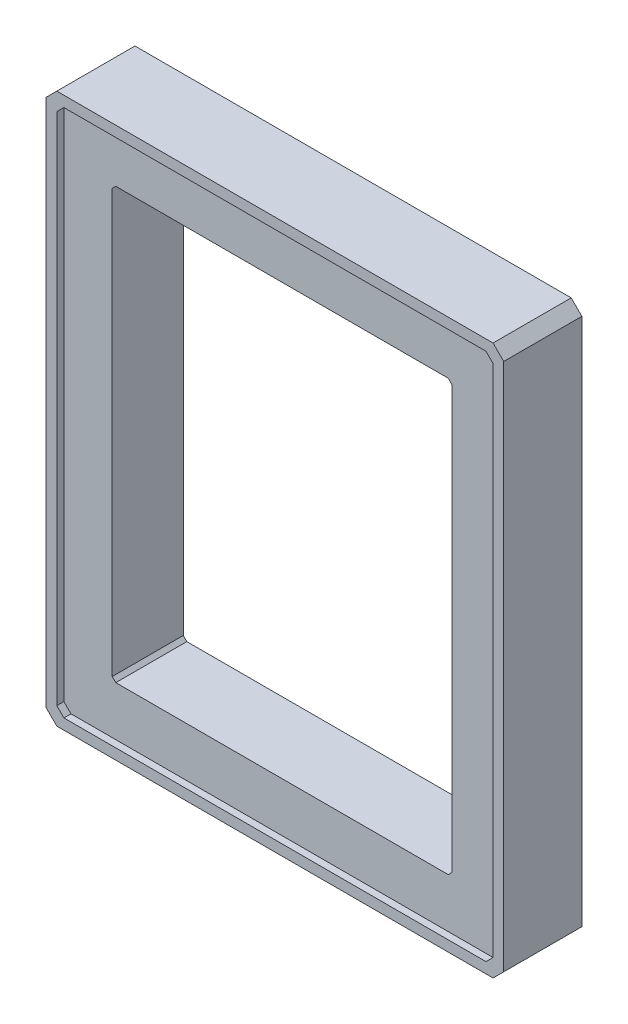
from build123d import *

# Parameters (mm, degrees)
SUPPORT_PLANE_EXACTLY_20MM_ABOVE_TABLE_DEPTH   = 20
LOW_LOCATING_LIP_0P4MM_CLEARANCE_EACH_SI_START = 20
LOW_LOCATING_LIP_0P4MM_CLEARANCE_EACH_SI_DEPTH = 2


with BuildPart() as part:
    # 草图1 → Support_plane_exactly_20mm_above_table (new body)
    with BuildSketch(Plane.XY):
        Polygon((-61.4, -77.4), (61.4, -77.4), (64.4, -74.4), (64.4, 74.4), (61.4, 77.4), (-61.4, 77.4), (-64.4, 74.4), (-64.4, -74.4), align=None)
        Polygon((-46.8, -60.5), (46.8, -60.5), (47.8, -59.5), (47.8, 59.5), (46.8, 60.5), (-46.8, 60.5), (-47.8, 59.5), (-47.8, -59.5), align=None, mode=Mode.SUBTRACT)
    extrude(amount=SUPPORT_PLANE_EXACTLY_20MM_ABOVE_TABLE_DEPTH)

    # 草图2 → Low_locating_lip_0p4mm_clearance_each_side (add)
    with BuildSketch(Plane.XY.offset(LOW_LOCATING_LIP_0P4MM_CLEARANCE_EACH_SI_START)):
        Polygon((-61.4, -77.4), (61.4, -77.4), (64.4, -74.4), (64.4, 74.4), (61.4, 77.4), (-61.4, 77.4), (-64.4, 74.4), (-64.4, -74.4), align=None)
        Polygon((-59.4, -74.4), (59.4, -74.4), (61.4, -72.4), (61.4, 72.4), (59.4, 74.4), (-59.4, 74.4), (-61.4, 72.4), (-61.4, -72.4), align=None, mode=Mode.SUBTRACT)
    extrude(amount=LOW_LOCATING_LIP_0P4MM_CLEARANCE_EACH_SI_DEPTH)


solid = part.part
